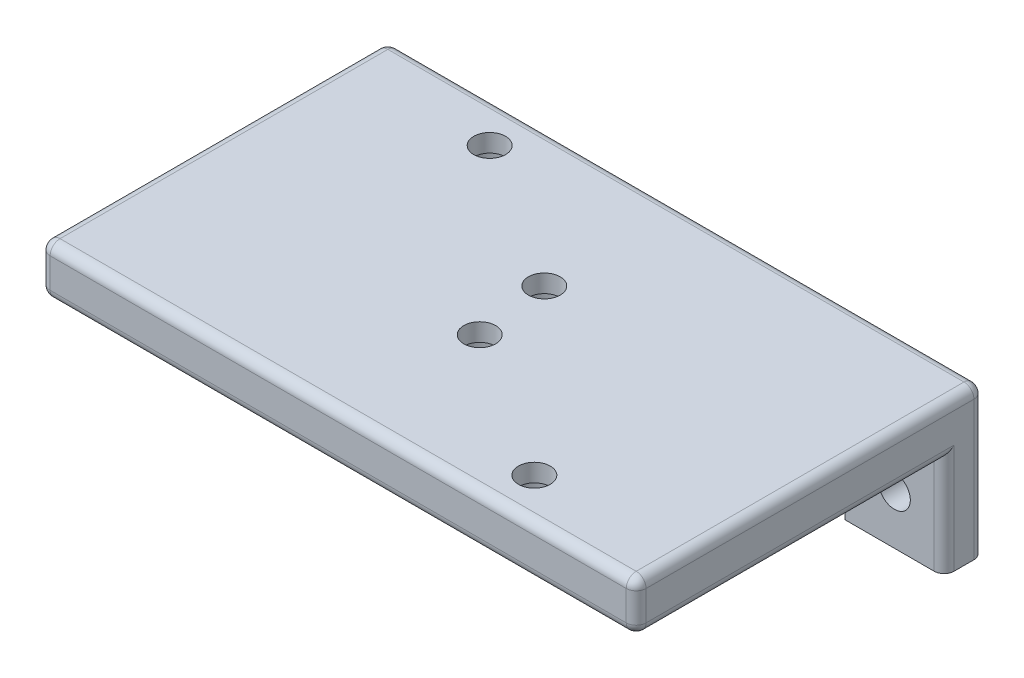
from build123d import *

# Parameters (mm, degrees)
SKETCH_1_R          = 1.6
EXTRUDE_1_DEPTH     = 4
SKETCH_2_W          = 60
SKETCH_2_H          = 5
EXTRUDE_2_DEPTH     = 31
SKETCH_8_R          = 1.6
CUT_EXTRUDE_1_DEPTH = 48.16990566
SKETCH_9_R          = 3
CUT_EXTRUDE_2_DEPTH = 3.2
FILLET_2_R          = 1


with BuildPart() as part:
    # 草图1 → 凸台-拉伸1 (new body)
    with BuildSketch(Plane.XY):
        Polygon((20, 0), (30, 0), (30, 15), (-30, 15), (-30, 0), (-20, 0), (-20, 10), (20, 10), align=None)
        with Locations((-25, 5)):
            Circle(SKETCH_1_R, mode=Mode.SUBTRACT)
        with Locations((25, 5)):
            Circle(SKETCH_1_R, mode=Mode.SUBTRACT)
    extrude(amount=EXTRUDE_1_DEPTH)

    # 草图2 → 凸台-拉伸2 (add)
    with BuildSketch(Plane.XY.offset(4)):
        with Locations((0, 12.5)):
            Rectangle(SKETCH_2_W, SKETCH_2_H)
    extrude(amount=EXTRUDE_2_DEPTH)

    # 草图8 → 切除-拉伸1 (cut, through all)
    with BuildSketch(Plane.XZ.offset(-10)):
        with Locations((-15.5, 4.25)):
            Circle(SKETCH_8_R)
        with Locations((-0.5, 13.75)):
            Circle(SKETCH_8_R)
        with Locations((0.5, 21.25)):
            Circle(SKETCH_8_R)
        with Locations((15.5, 30.75)):
            Circle(SKETCH_8_R)
    extrude(amount=-CUT_EXTRUDE_1_DEPTH, mode=Mode.SUBTRACT)

    # 草图9 → 切除-拉伸2 (cut)
    with BuildSketch(Plane.XZ.offset(-10)):
        with Locations((-15.5, 4.25)):
            Circle(SKETCH_9_R)
        with Locations((-0.5, 13.75)):
            Circle(SKETCH_9_R)
        with Locations((0.5, 21.25)):
            Circle(SKETCH_9_R)
        with Locations((15.5, 30.75)):
            Circle(SKETCH_9_R)
    extrude(amount=-CUT_EXTRUDE_2_DEPTH, mode=Mode.SUBTRACT)

    # 圆角2
    fillet_2_edges = [part.edges().sort_by_distance(p)[0] for p in [
        (0, 10, 0),
        (-20, 5, 0),
        (-30, 7.5, 0),
        (-30, 15, 17.5),
        (30, 15, 17.5),
        (20, 10, 2),
        (-20, 10, 2),
        (30, 5, 4),
        (-30, 5, 4),
        (-30, 10, 19.5),
        (30, 10, 19.5),
        (-30, 12.5, 35),
        (0, 10, 35),
        (30, 12.5, 35),
        (0, 15, 35),
        (0, 15, 0),
        (30, 7.5, 0),
        (20, 5, 0),
    ]]
    fillet(fillet_2_edges, radius=FILLET_2_R)


solid = part.part
